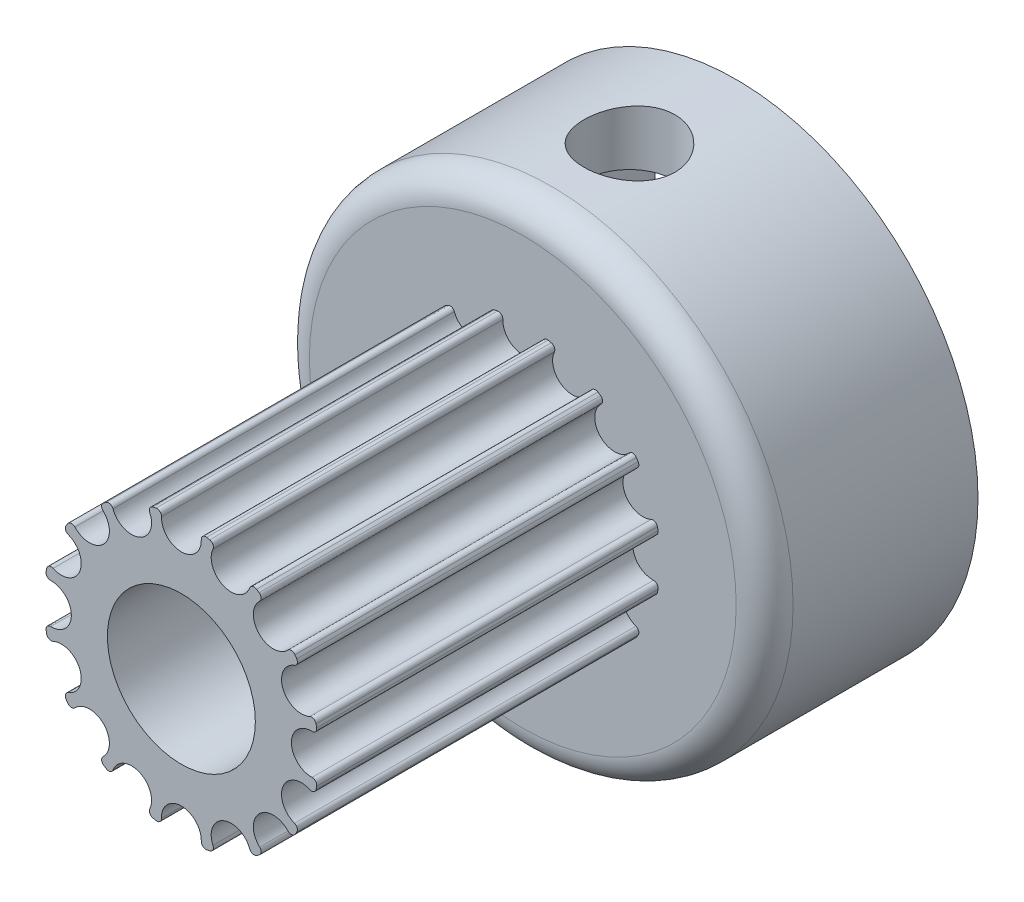
from build123d import *

# Parameters (mm, degrees)
SKETCH_1_R          = 8.5
SKETCH_1_R_2        = 2.6
EXTRUDE_1_DEPTH     = 7.5
FILLET_1_R          = 1
SKETCH_6_R          = 2.6
EXTRUDE_2_DEPTH     = 12
SKETCH_4_R          = 1.6
CUT_EXTRUDE_1_DEPTH = 23.907422415
SKETCH_5_W          = 5.7
SKETCH_5_H          = 2.7
CUT_EXTRUDE_2_DEPTH = 7.05


with BuildPart() as part:
    # 草图1 → 凸台-拉伸1 (new body)
    with BuildSketch(Plane.XY):
        Circle(SKETCH_1_R)
        Circle(SKETCH_1_R_2, mode=Mode.SUBTRACT)
    extrude(amount=EXTRUDE_1_DEPTH)

    # 圆角1
    fillet_1_edges = [part.edges().sort_by_distance(p)[0] for p in [
        (-8.5, 0, 7.5),
    ]]
    fillet(fillet_1_edges, radius=FILLET_1_R)

    # 草图6 → 凸台-拉伸2 (add)
    with BuildSketch(Plane.XY.offset(7.5)):
        with BuildLine():
            ThreePointArc((-0.888859814, 4.755603807), (-0.943838819, 4.744998169), (-0.998691399, 4.733756947))
            ThreePointArc((-0.998691399, 4.733756947), (-1.108499785, 4.649297568), (-1.111229207, 4.510791906))
            ThreePointArc((-1.111229207, 4.510791906), (-1.480203512, 3.573527394), (-2.403853838, 3.975369253))
            ThreePointArc((-2.403853838, 3.975369253), (-2.503722124, 4.071377553), (-2.641090177, 4.053453098))
            ThreePointArc((-2.641090177, 4.053453098), (-2.687825553, 4.022615211), (-2.734200899, 3.991238503))
            ThreePointArc((-2.734200899, 3.991238503), (-2.803329414, 3.871186362), (-2.752847249, 3.742179311))
            ThreePointArc((-2.752847249, 3.742179311), (-2.735059458, 2.735059458), (-3.742179311, 2.752847249))
            ThreePointArc((-3.742179311, 2.752847249), (-3.871186362, 2.803329414), (-3.991238503, 2.734200899))
            ThreePointArc((-3.991238503, 2.734200899), (-4.022615211, 2.687825553), (-4.053453098, 2.641090177))
            ThreePointArc((-4.053453098, 2.641090177), (-4.071377553, 2.503722124), (-3.975369253, 2.403853838))
            ThreePointArc((-3.975369253, 2.403853838), (-3.573527394, 1.480203512), (-4.510791906, 1.111229207))
            ThreePointArc((-4.510791906, 1.111229207), (-4.649297568, 1.108499785), (-4.733756947, 0.998691399))
            ThreePointArc((-4.733756947, 0.998691399), (-4.744998169, 0.943838819), (-4.755603807, 0.888859814))
            ThreePointArc((-4.755603807, 0.888859814), (-4.719595366, 0.755088889), (-4.592677324, 0.699563409))
            ThreePointArc((-4.592677324, 0.699563409), (-3.867958179, 0), (-4.592677324, -0.699563409))
            ThreePointArc((-4.592677324, -0.699563409), (-4.719595366, -0.755088889), (-4.755603807, -0.888859814))
            ThreePointArc((-4.755603807, -0.888859814), (-4.744998169, -0.943838819), (-4.733756947, -0.998691399))
            ThreePointArc((-4.733756947, -0.998691399), (-4.649297568, -1.108499785), (-4.510791906, -1.111229207))
            ThreePointArc((-4.510791906, -1.111229207), (-3.573527394, -1.480203512), (-3.975369253, -2.403853838))
            ThreePointArc((-3.975369253, -2.403853838), (-4.071377553, -2.503722124), (-4.053453098, -2.641090177))
            ThreePointArc((-4.053453098, -2.641090177), (-4.022615211, -2.687825553), (-3.991238503, -2.734200899))
            ThreePointArc((-3.991238503, -2.734200899), (-3.871186362, -2.803329414), (-3.742179311, -2.752847249))
            ThreePointArc((-3.742179311, -2.752847249), (-2.735059458, -2.735059458), (-2.752847249, -3.742179311))
            ThreePointArc((-2.752847249, -3.742179311), (-2.803329414, -3.871186362), (-2.734200899, -3.991238503))
            ThreePointArc((-2.734200899, -3.991238503), (-2.687825553, -4.022615211), (-2.641090177, -4.053453098))
            ThreePointArc((-2.641090177, -4.053453098), (-2.503722124, -4.071377553), (-2.403853838, -3.975369253))
            ThreePointArc((-2.403853838, -3.975369253), (-1.480203512, -3.573527394), (-1.111229207, -4.510791906))
            ThreePointArc((-1.111229207, -4.510791906), (-1.108499785, -4.649297568), (-0.998691399, -4.733756947))
            ThreePointArc((-0.998691399, -4.733756947), (-0.943838819, -4.744998169), (-0.888859814, -4.755603807))
            ThreePointArc((-0.888859814, -4.755603807), (-0.755088889, -4.719595366), (-0.699563409, -4.592677324))
            ThreePointArc((-0.699563409, -4.592677324), (0, -3.867958179), (0.699563409, -4.592677324))
            ThreePointArc((0.699563409, -4.592677324), (0.755088889, -4.719595366), (0.888859814, -4.755603807))
            ThreePointArc((0.888859814, -4.755603807), (0.943838819, -4.744998169), (0.998691399, -4.733756947))
            ThreePointArc((0.998691399, -4.733756947), (1.108499785, -4.649297568), (1.111229207, -4.510791906))
            ThreePointArc((1.111229207, -4.510791906), (1.480203512, -3.573527394), (2.403853838, -3.975369253))
            ThreePointArc((2.403853838, -3.975369253), (2.503722124, -4.071377553), (2.641090177, -4.053453098))
            ThreePointArc((2.641090177, -4.053453098), (2.687825553, -4.022615211), (2.734200899, -3.991238503))
            ThreePointArc((2.734200899, -3.991238503), (2.803329414, -3.871186362), (2.752847249, -3.742179311))
            ThreePointArc((2.752847249, -3.742179311), (2.735059458, -2.735059458), (3.742179311, -2.752847249))
            ThreePointArc((3.742179311, -2.752847249), (3.871186362, -2.803329414), (3.991238503, -2.734200899))
            ThreePointArc((3.991238503, -2.734200899), (4.022615211, -2.687825553), (4.053453098, -2.641090177))
            ThreePointArc((4.053453098, -2.641090177), (4.071377553, -2.503722124), (3.975369253, -2.403853838))
            ThreePointArc((3.975369253, -2.403853838), (3.573527394, -1.480203512), (4.510791906, -1.111229207))
            ThreePointArc((4.510791906, -1.111229207), (4.649297568, -1.108499785), (4.733756947, -0.998691399))
            ThreePointArc((4.733756947, -0.998691399), (4.744998169, -0.943838819), (4.755603807, -0.888859814))
            ThreePointArc((4.755603807, -0.888859814), (4.719595366, -0.755088889), (4.592677324, -0.699563409))
            ThreePointArc((4.592677324, -0.699563409), (3.867958179, 0), (4.592677324, 0.699563409))
            ThreePointArc((4.592677324, 0.699563409), (4.719595366, 0.755088889), (4.755603807, 0.888859814))
            ThreePointArc((4.755603807, 0.888859814), (4.744998169, 0.943838819), (4.733756947, 0.998691399))
            ThreePointArc((4.733756947, 0.998691399), (4.649297568, 1.108499785), (4.510791906, 1.111229207))
            ThreePointArc((4.510791906, 1.111229207), (3.573527394, 1.480203512), (3.975369253, 2.403853838))
            ThreePointArc((3.975369253, 2.403853838), (4.071377553, 2.503722124), (4.053453098, 2.641090177))
            ThreePointArc((4.053453098, 2.641090177), (4.022615211, 2.687825553), (3.991238503, 2.734200899))
            ThreePointArc((3.991238503, 2.734200899), (3.871186362, 2.803329414), (3.742179311, 2.752847249))
            ThreePointArc((3.742179311, 2.752847249), (2.735059458, 2.735059458), (2.752847249, 3.742179311))
            ThreePointArc((2.752847249, 3.742179311), (2.803329414, 3.871186362), (2.734200899, 3.991238503))
            ThreePointArc((2.734200899, 3.991238503), (2.687825553, 4.022615211), (2.641090177, 4.053453098))
            ThreePointArc((2.641090177, 4.053453098), (2.503722124, 4.071377553), (2.403853838, 3.975369253))
            ThreePointArc((2.403853838, 3.975369253), (1.480203512, 3.573527394), (1.111229207, 4.510791906))
            ThreePointArc((1.111229207, 4.510791906), (1.108499785, 4.649297568), (0.998691399, 4.733756947))
            ThreePointArc((0.998691399, 4.733756947), (0.943838819, 4.744998169), (0.888859814, 4.755603807))
            ThreePointArc((0.888859814, 4.755603807), (0.755088889, 4.719595366), (0.699563409, 4.592677324))
            ThreePointArc((0.699563409, 4.592677324), (0, 3.867958179), (-0.699563409, 4.592677324))
            ThreePointArc((-0.699563409, 4.592677324), (-0.755088889, 4.719595366), (-0.888859814, 4.755603807))
        make_face()
        Circle(SKETCH_6_R, mode=Mode.SUBTRACT)
    extrude(amount=EXTRUDE_2_DEPTH)

    # 草图4 → 切除-拉伸1 (cut, symmetric)
    with BuildSketch(Plane(origin=(0, 0, 0), x_dir=(1, 0, 0), z_dir=(0, 1, 0))):
        with Locations(Location((0, -3.75, 0), (0, 0, 270))):
            Circle(SKETCH_4_R)
    cut_extrude_1 = extrude(amount=CUT_EXTRUDE_1_DEPTH, both=True, mode=Mode.SUBTRACT)

    # 草图5 → 切除-拉伸2 (cut)
    with BuildSketch(Plane(origin=(0, 0, 0), x_dir=(-1, 0, 0), z_dir=(0, 0, -1))):
        with Locations((0, 5.15)):
            Rectangle(SKETCH_5_W, SKETCH_5_H)
    cut_extrude_2 = extrude(amount=-CUT_EXTRUDE_2_DEPTH, mode=Mode.SUBTRACT)

    # 镜向1: 切除-拉伸1, 切除-拉伸2 across plane
    add(cut_extrude_1.mirror(Plane.ZX), mode=Mode.SUBTRACT)
    add(cut_extrude_2.mirror(Plane.ZX), mode=Mode.SUBTRACT)


solid = part.part
